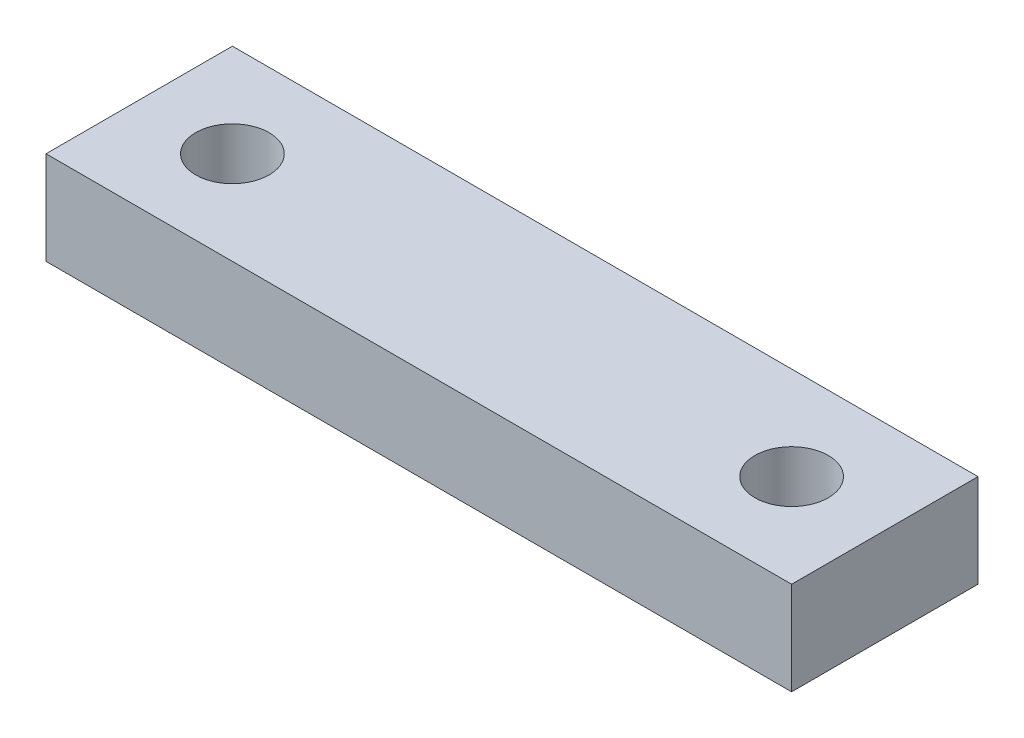
from build123d import *

# Parameters (mm, degrees)
SKETCH1_W             = 50.8
SKETCH1_H             = 12.7
BOSS_EXTRUDE1_DEPTH   = 6.35
F_5_0MM_DOWEL_HOLE1_D = 5


with BuildPart() as part:
    # Sketch1 → Boss-Extrude1 (new body)
    with BuildSketch(Plane(origin=(0, 0, 0), x_dir=(1, 0, 0), z_dir=(0, 1, 0))):
        with Locations((25.4, 6.35)):
            Rectangle(SKETCH1_W, SKETCH1_H)
    extrude(amount=BOSS_EXTRUDE1_DEPTH)

    # Ø5.0mm Dowel Hole1 (through all)
    with Locations(Plane(origin=(0, 6.35, 0), x_dir=(1, 0, 0), z_dir=(0, 1, 0))):
        with Locations((6.35, 6.35), (44.45, 6.35)):
            Hole(F_5_0MM_DOWEL_HOLE1_D / 2)


solid = part.part
